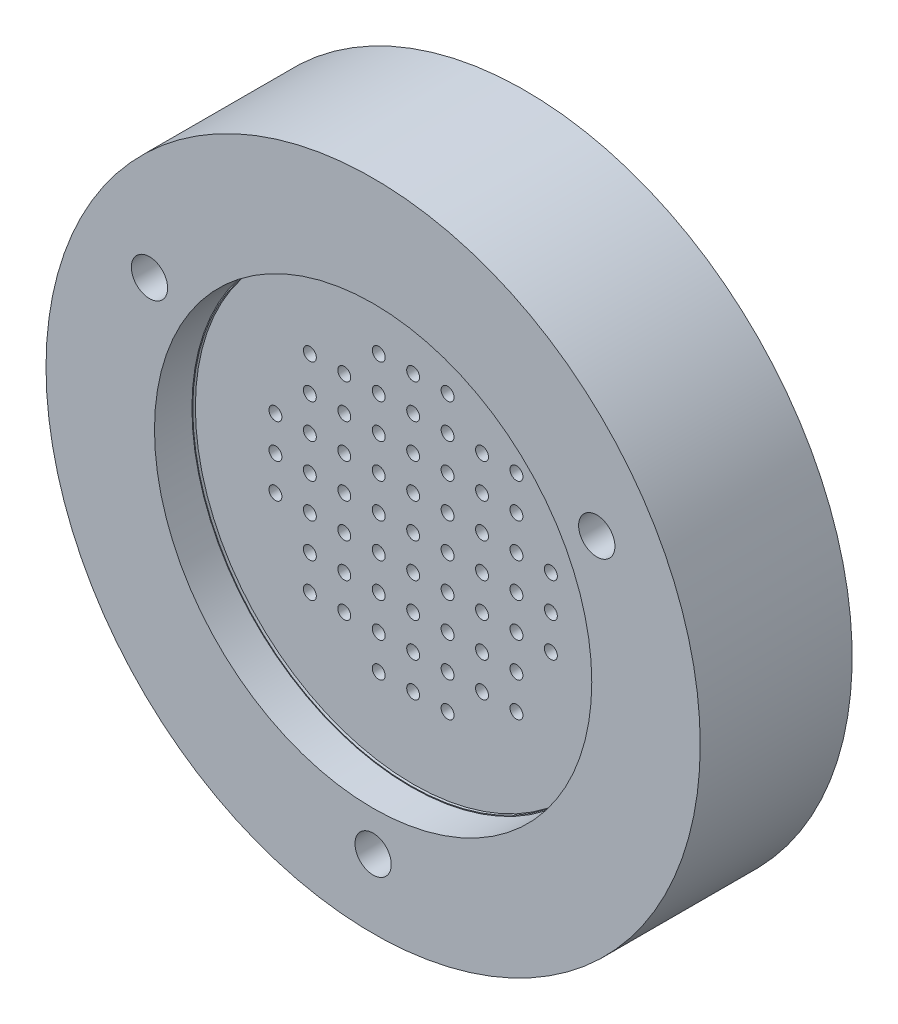
from build123d import *

# Parameters (mm, degrees)
SKETCH1_R                                  = 38
BOSS_EXTRUDE1_DEPTH                        = 5
SKETCH2_R                                  = 0.75
CUT_EXTRUDE1_DEPTH                         = 54.972215074
LPATTERN1_COUNT                            = 5
LPATTERN1_PITCH                            = 4
LPATTERN1_COUNT_DIR2                       = 5
LPATTERN1_PITCH_DIR2                       = 4
MIRROR1_COPY_1_SKETCH_R                    = 0.75
MIRROR1_COPY_1_DEPTH                       = 54.972215074
MIRROR1_COPY_2_SKETCH_R                    = 0.75
MIRROR1_COPY_2_DEPTH                       = 54.972215074
MIRROR1_COPY_3_SKETCH_R                    = 0.75
MIRROR1_COPY_3_DEPTH                       = 54.972215074
MIRROR1_COPY_4_SKETCH_R                    = 0.75
MIRROR1_COPY_4_DEPTH                       = 54.972215074
MIRROR1_COPY_5_SKETCH_R                    = 0.75
MIRROR1_COPY_5_DEPTH                       = 54.972215074
MIRROR1_COPY_6_SKETCH_R                    = 0.75
MIRROR1_COPY_6_DEPTH                       = 54.972215074
MIRROR1_COPY_7_SKETCH_R                    = 0.75
MIRROR1_COPY_7_DEPTH                       = 54.972215074
MIRROR1_COPY_8_SKETCH_R                    = 0.75
MIRROR1_COPY_8_DEPTH                       = 54.972215074
MIRROR1_COPY_9_SKETCH_R                    = 0.75
MIRROR1_COPY_9_DEPTH                       = 54.972215074
MIRROR1_COPY_10_SKETCH_R                   = 0.75
MIRROR1_COPY_10_DEPTH                      = 54.972215074
MIRROR1_COPY_11_SKETCH_R                   = 0.75
MIRROR1_COPY_11_DEPTH                      = 54.972215074
MIRROR1_COPY_12_SKETCH_R                   = 0.75
MIRROR1_COPY_12_DEPTH                      = 54.972215074
MIRROR1_COPY_13_SKETCH_R                   = 0.75
MIRROR1_COPY_13_DEPTH                      = 54.972215074
MIRROR1_COPY_14_SKETCH_R                   = 0.75
MIRROR1_COPY_14_DEPTH                      = 54.972215074
MIRROR1_COPY_15_SKETCH_R                   = 0.75
MIRROR1_COPY_15_DEPTH                      = 54.972215074
MIRROR1_COPY_16_SKETCH_R                   = 0.75
MIRROR1_COPY_16_DEPTH                      = 54.972215074
MIRROR1_COPY_17_SKETCH_R                   = 0.75
MIRROR1_COPY_17_DEPTH                      = 54.972215074
MIRROR1_COPY_18_SKETCH_R                   = 0.75
MIRROR1_COPY_18_DEPTH                      = 54.972215074
MIRROR1_COPY_19_SKETCH_R                   = 0.75
MIRROR1_COPY_19_DEPTH                      = 54.972215074
MIRROR1_COPY_20_SKETCH_R                   = 0.75
MIRROR1_COPY_20_DEPTH                      = 54.972215074
MIRROR1_AT_THE_SECOND_PLANE_COPY_1_SKETC_R = 0.75
MIRROR1_AT_THE_SECOND_PLANE_COPY_1_DEPTH   = 54.972215074
MIRROR1_AT_THE_SECOND_PLANE_COPY_2_SKETC_R = 0.75
MIRROR1_AT_THE_SECOND_PLANE_COPY_2_DEPTH   = 54.972215074
MIRROR1_AT_THE_SECOND_PLANE_COPY_3_SKETC_R = 0.75
MIRROR1_AT_THE_SECOND_PLANE_COPY_3_DEPTH   = 54.972215074
MIRROR1_AT_THE_SECOND_PLANE_COPY_4_SKETC_R = 0.75
MIRROR1_AT_THE_SECOND_PLANE_COPY_4_DEPTH   = 54.972215074
MIRROR1_AT_THE_SECOND_PLANE_COPY_5_SKETC_R = 0.75
MIRROR1_AT_THE_SECOND_PLANE_COPY_5_DEPTH   = 54.972215074
MIRROR1_AT_THE_SECOND_PLANE_COPY_6_SKETC_R = 0.75
MIRROR1_AT_THE_SECOND_PLANE_COPY_6_DEPTH   = 54.972215074
MIRROR1_AT_THE_SECOND_PLANE_COPY_7_SKETC_R = 0.75
MIRROR1_AT_THE_SECOND_PLANE_COPY_7_DEPTH   = 54.972215074
MIRROR1_AT_THE_SECOND_PLANE_COPY_8_SKETC_R = 0.75
MIRROR1_AT_THE_SECOND_PLANE_COPY_8_DEPTH   = 54.972215074
MIRROR1_AT_THE_SECOND_PLANE_COPY_9_SKETC_R = 0.75
MIRROR1_AT_THE_SECOND_PLANE_COPY_9_DEPTH   = 54.972215074
MIRROR1_AT_THE_SECOND_PLANE_COPY_10_SKET_R = 0.75
MIRROR1_AT_THE_SECOND_PLANE_COPY_10_DEPTH  = 54.972215074
MIRROR1_AT_THE_SECOND_PLANE_COPY_11_SKET_R = 0.75
MIRROR1_AT_THE_SECOND_PLANE_COPY_11_DEPTH  = 54.972215074
MIRROR1_AT_THE_SECOND_PLANE_COPY_12_SKET_R = 0.75
MIRROR1_AT_THE_SECOND_PLANE_COPY_12_DEPTH  = 54.972215074
MIRROR1_AT_THE_SECOND_PLANE_COPY_13_SKET_R = 0.75
MIRROR1_AT_THE_SECOND_PLANE_COPY_13_DEPTH  = 54.972215074
MIRROR1_AT_THE_SECOND_PLANE_COPY_14_SKET_R = 0.75
MIRROR1_AT_THE_SECOND_PLANE_COPY_14_DEPTH  = 54.972215074
MIRROR1_AT_THE_SECOND_PLANE_COPY_15_SKET_R = 0.75
MIRROR1_AT_THE_SECOND_PLANE_COPY_15_DEPTH  = 54.972215074
MIRROR1_AT_THE_SECOND_PLANE_COPY_16_SKET_R = 0.75
MIRROR1_AT_THE_SECOND_PLANE_COPY_16_DEPTH  = 54.972215074
MIRROR1_AT_THE_SECOND_PLANE_COPY_17_SKET_R = 0.75
MIRROR1_AT_THE_SECOND_PLANE_COPY_17_DEPTH  = 54.972215074
MIRROR1_AT_THE_SECOND_PLANE_COPY_18_SKET_R = 0.75
MIRROR1_AT_THE_SECOND_PLANE_COPY_18_DEPTH  = 54.972215074
MIRROR1_AT_THE_SECOND_PLANE_COPY_19_SKET_R = 0.75
MIRROR1_AT_THE_SECOND_PLANE_COPY_19_DEPTH  = 54.972215074
MIRROR1_AT_THE_SECOND_PLANE_COPY_20_SKET_R = 0.75
MIRROR1_AT_THE_SECOND_PLANE_COPY_20_DEPTH  = 54.972215074
MIRROR1_AT_THE_SECOND_PLANE_COPY_21_SKET_R = 0.75
MIRROR1_AT_THE_SECOND_PLANE_COPY_21_DEPTH  = 54.972215074
MIRROR1_AT_THE_SECOND_PLANE_COPY_22_SKET_R = 0.75
MIRROR1_AT_THE_SECOND_PLANE_COPY_22_DEPTH  = 54.972215074
MIRROR1_AT_THE_SECOND_PLANE_COPY_23_SKET_R = 0.75
MIRROR1_AT_THE_SECOND_PLANE_COPY_23_DEPTH  = 54.972215074
MIRROR1_AT_THE_SECOND_PLANE_COPY_24_SKET_R = 0.75
MIRROR1_AT_THE_SECOND_PLANE_COPY_24_DEPTH  = 54.972215074
MIRROR1_AT_THE_SECOND_PLANE_COPY_25_SKET_R = 0.75
MIRROR1_AT_THE_SECOND_PLANE_COPY_25_DEPTH  = 54.972215074
MIRROR1_AT_THE_SECOND_PLANE_COPY_26_SKET_R = 0.75
MIRROR1_AT_THE_SECOND_PLANE_COPY_26_DEPTH  = 54.972215074
MIRROR1_AT_THE_SECOND_PLANE_COPY_27_SKET_R = 0.75
MIRROR1_AT_THE_SECOND_PLANE_COPY_27_DEPTH  = 54.972215074
MIRROR1_AT_THE_SECOND_PLANE_COPY_28_SKET_R = 0.75
MIRROR1_AT_THE_SECOND_PLANE_COPY_28_DEPTH  = 54.972215074
MIRROR1_AT_THE_SECOND_PLANE_COPY_29_SKET_R = 0.75
MIRROR1_AT_THE_SECOND_PLANE_COPY_29_DEPTH  = 54.972215074
MIRROR1_AT_THE_SECOND_PLANE_COPY_30_SKET_R = 0.75
MIRROR1_AT_THE_SECOND_PLANE_COPY_30_DEPTH  = 54.972215074
MIRROR1_AT_THE_SECOND_PLANE_COPY_31_SKET_R = 0.75
MIRROR1_AT_THE_SECOND_PLANE_COPY_31_DEPTH  = 54.972215074
MIRROR1_AT_THE_SECOND_PLANE_COPY_32_SKET_R = 0.75
MIRROR1_AT_THE_SECOND_PLANE_COPY_32_DEPTH  = 54.972215074
MIRROR1_AT_THE_SECOND_PLANE_COPY_33_SKET_R = 0.75
MIRROR1_AT_THE_SECOND_PLANE_COPY_33_DEPTH  = 54.972215074
MIRROR1_AT_THE_SECOND_PLANE_COPY_34_SKET_R = 0.75
MIRROR1_AT_THE_SECOND_PLANE_COPY_34_DEPTH  = 54.972215074
MIRROR1_AT_THE_SECOND_PLANE_COPY_35_SKET_R = 0.75
MIRROR1_AT_THE_SECOND_PLANE_COPY_35_DEPTH  = 54.972215074
MIRROR1_AT_THE_SECOND_PLANE_COPY_36_SKET_R = 0.75
MIRROR1_AT_THE_SECOND_PLANE_COPY_36_DEPTH  = 54.972215074
MIRROR1_AT_THE_SECOND_PLANE_COPY_37_SKET_R = 0.75
MIRROR1_AT_THE_SECOND_PLANE_COPY_37_DEPTH  = 54.972215074
MIRROR1_AT_THE_SECOND_PLANE_COPY_38_SKET_R = 0.75
MIRROR1_AT_THE_SECOND_PLANE_COPY_38_DEPTH  = 54.972215074
MIRROR1_AT_THE_SECOND_PLANE_COPY_39_SKET_R = 0.75
MIRROR1_AT_THE_SECOND_PLANE_COPY_39_DEPTH  = 54.972215074
MIRROR1_AT_THE_SECOND_PLANE_COPY_40_SKET_R = 0.75
MIRROR1_AT_THE_SECOND_PLANE_COPY_40_DEPTH  = 54.972215074
MIRROR1_AT_THE_SECOND_PLANE_COPY_41_SKET_R = 0.75
MIRROR1_AT_THE_SECOND_PLANE_COPY_41_DEPTH  = 54.972215074
SKETCH16_R                                 = 38
SKETCH16_R_2                               = 25.4
BOSS_EXTRUDE2_DEPTH                        = 4.65
BOSS_EXTRUDE3_START                        = 8
SKETCH17_R                                 = 38
SKETCH17_R_2                               = 33
BOSS_EXTRUDE3_DEPTH                        = 8
HOLE_FOR_4_300_SC_NUTS_SP_3_D              = 4.2164
CIRPATTERN1_COUNT                          = 3
CIRPATTERN2_COUNT                          = 3
SKETCH43_R                                 = 26.3
SKETCH43_R_2                               = 25.3
BOSS_EXTRUDE4_DEPTH                        = 0.3


with BuildPart() as part:
    # Sketch1 → Boss-Extrude1 (new body)
    with BuildSketch(Plane.XY):
        Circle(SKETCH1_R)
    extrude(amount=BOSS_EXTRUDE1_DEPTH)

    # Sketch2 → Cut-Extrude1 (cut, through all)
    with BuildSketch(Plane.XY.offset(5)):
        Circle(SKETCH2_R)
    cut_extrude1 = extrude(amount=-CUT_EXTRUDE1_DEPTH, mode=Mode.SUBTRACT)

    # LPattern1: Cut-Extrude1 5 × 5, 5 skipped
    with Locations(*[(j * LPATTERN1_PITCH_DIR2, i * LPATTERN1_PITCH, 0) for i in range(LPATTERN1_COUNT) for j in range(LPATTERN1_COUNT_DIR2) if (i, j) not in ((0, 0), (2, 4), (3, 4), (4, 2), (4, 3), (4, 4))]):
        add(cut_extrude1, mode=Mode.SUBTRACT)

    # Mirror1 copy 1 sketch → Mirror1 copy 1 (cut, through all)
    with BuildSketch(Plane(origin=(-4, 0, 5), x_dir=(-1, 0, 0), z_dir=(0, 0, 1))):
        Circle(MIRROR1_COPY_1_SKETCH_R)
    extrude(amount=-MIRROR1_COPY_1_DEPTH, mode=Mode.SUBTRACT)

    # Mirror1 copy 2 sketch → Mirror1 copy 2 (cut, through all)
    with BuildSketch(Plane(origin=(-8, 0, 5), x_dir=(-1, 0, 0), z_dir=(0, 0, 1))):
        Circle(MIRROR1_COPY_2_SKETCH_R)
    extrude(amount=-MIRROR1_COPY_2_DEPTH, mode=Mode.SUBTRACT)

    # Mirror1 copy 3 sketch → Mirror1 copy 3 (cut, through all)
    with BuildSketch(Plane(origin=(-12, 0, 5), x_dir=(-1, 0, 0), z_dir=(0, 0, 1))):
        Circle(MIRROR1_COPY_3_SKETCH_R)
    extrude(amount=-MIRROR1_COPY_3_DEPTH, mode=Mode.SUBTRACT)

    # Mirror1 copy 4 sketch → Mirror1 copy 4 (cut, through all)
    with BuildSketch(Plane(origin=(-16, 0, 5), x_dir=(-1, 0, 0), z_dir=(0, 0, 1))):
        Circle(MIRROR1_COPY_4_SKETCH_R)
    extrude(amount=-MIRROR1_COPY_4_DEPTH, mode=Mode.SUBTRACT)

    # Mirror1 copy 5 sketch → Mirror1 copy 5 (cut, through all)
    with BuildSketch(Plane(origin=(0, 4, 5), x_dir=(-1, 0, 0), z_dir=(0, 0, 1))):
        Circle(MIRROR1_COPY_5_SKETCH_R)
    extrude(amount=-MIRROR1_COPY_5_DEPTH, mode=Mode.SUBTRACT)

    # Mirror1 copy 6 sketch → Mirror1 copy 6 (cut, through all)
    with BuildSketch(Plane(origin=(-4, 4, 5), x_dir=(-1, 0, 0), z_dir=(0, 0, 1))):
        Circle(MIRROR1_COPY_6_SKETCH_R)
    extrude(amount=-MIRROR1_COPY_6_DEPTH, mode=Mode.SUBTRACT)

    # Mirror1 copy 7 sketch → Mirror1 copy 7 (cut, through all)
    with BuildSketch(Plane(origin=(-8, 4, 5), x_dir=(-1, 0, 0), z_dir=(0, 0, 1))):
        Circle(MIRROR1_COPY_7_SKETCH_R)
    extrude(amount=-MIRROR1_COPY_7_DEPTH, mode=Mode.SUBTRACT)

    # Mirror1 copy 8 sketch → Mirror1 copy 8 (cut, through all)
    with BuildSketch(Plane(origin=(-12, 4, 5), x_dir=(-1, 0, 0), z_dir=(0, 0, 1))):
        Circle(MIRROR1_COPY_8_SKETCH_R)
    extrude(amount=-MIRROR1_COPY_8_DEPTH, mode=Mode.SUBTRACT)

    # Mirror1 copy 9 sketch → Mirror1 copy 9 (cut, through all)
    with BuildSketch(Plane(origin=(-16, 4, 5), x_dir=(-1, 0, 0), z_dir=(0, 0, 1))):
        Circle(MIRROR1_COPY_9_SKETCH_R)
    extrude(amount=-MIRROR1_COPY_9_DEPTH, mode=Mode.SUBTRACT)

    # Mirror1 copy 10 sketch → Mirror1 copy 10 (cut, through all)
    with BuildSketch(Plane(origin=(0, 8, 5), x_dir=(-1, 0, 0), z_dir=(0, 0, 1))):
        Circle(MIRROR1_COPY_10_SKETCH_R)
    extrude(amount=-MIRROR1_COPY_10_DEPTH, mode=Mode.SUBTRACT)

    # Mirror1 copy 11 sketch → Mirror1 copy 11 (cut, through all)
    with BuildSketch(Plane(origin=(-4, 8, 5), x_dir=(-1, 0, 0), z_dir=(0, 0, 1))):
        Circle(MIRROR1_COPY_11_SKETCH_R)
    extrude(amount=-MIRROR1_COPY_11_DEPTH, mode=Mode.SUBTRACT)

    # Mirror1 copy 12 sketch → Mirror1 copy 12 (cut, through all)
    with BuildSketch(Plane(origin=(-8, 8, 5), x_dir=(-1, 0, 0), z_dir=(0, 0, 1))):
        Circle(MIRROR1_COPY_12_SKETCH_R)
    extrude(amount=-MIRROR1_COPY_12_DEPTH, mode=Mode.SUBTRACT)

    # Mirror1 copy 13 sketch → Mirror1 copy 13 (cut, through all)
    with BuildSketch(Plane(origin=(-12, 8, 5), x_dir=(-1, 0, 0), z_dir=(0, 0, 1))):
        Circle(MIRROR1_COPY_13_SKETCH_R)
    extrude(amount=-MIRROR1_COPY_13_DEPTH, mode=Mode.SUBTRACT)

    # Mirror1 copy 14 sketch → Mirror1 copy 14 (cut, through all)
    with BuildSketch(Plane(origin=(0, 12, 5), x_dir=(-1, 0, 0), z_dir=(0, 0, 1))):
        Circle(MIRROR1_COPY_14_SKETCH_R)
    extrude(amount=-MIRROR1_COPY_14_DEPTH, mode=Mode.SUBTRACT)

    # Mirror1 copy 15 sketch → Mirror1 copy 15 (cut, through all)
    with BuildSketch(Plane(origin=(-4, 12, 5), x_dir=(-1, 0, 0), z_dir=(0, 0, 1))):
        Circle(MIRROR1_COPY_15_SKETCH_R)
    extrude(amount=-MIRROR1_COPY_15_DEPTH, mode=Mode.SUBTRACT)

    # Mirror1 copy 16 sketch → Mirror1 copy 16 (cut, through all)
    with BuildSketch(Plane(origin=(-8, 12, 5), x_dir=(-1, 0, 0), z_dir=(0, 0, 1))):
        Circle(MIRROR1_COPY_16_SKETCH_R)
    extrude(amount=-MIRROR1_COPY_16_DEPTH, mode=Mode.SUBTRACT)

    # Mirror1 copy 17 sketch → Mirror1 copy 17 (cut, through all)
    with BuildSketch(Plane(origin=(-12, 12, 5), x_dir=(-1, 0, 0), z_dir=(0, 0, 1))):
        Circle(MIRROR1_COPY_17_SKETCH_R)
    extrude(amount=-MIRROR1_COPY_17_DEPTH, mode=Mode.SUBTRACT)

    # Mirror1 copy 18 sketch → Mirror1 copy 18 (cut, through all)
    with BuildSketch(Plane(origin=(0, 16, 5), x_dir=(-1, 0, 0), z_dir=(0, 0, 1))):
        Circle(MIRROR1_COPY_18_SKETCH_R)
    extrude(amount=-MIRROR1_COPY_18_DEPTH, mode=Mode.SUBTRACT)

    # Mirror1 copy 19 sketch → Mirror1 copy 19 (cut, through all)
    with BuildSketch(Plane(origin=(-4, 16, 5), x_dir=(-1, 0, 0), z_dir=(0, 0, 1))):
        Circle(MIRROR1_COPY_19_SKETCH_R)
    extrude(amount=-MIRROR1_COPY_19_DEPTH, mode=Mode.SUBTRACT)

    # Mirror1 copy 20 sketch → Mirror1 copy 20 (cut, through all)
    with BuildSketch(Plane(origin=(0, 0, 5), x_dir=(-1, 0, 0), z_dir=(0, 0, 1))):
        Circle(MIRROR1_COPY_20_SKETCH_R)
    extrude(amount=-MIRROR1_COPY_20_DEPTH, mode=Mode.SUBTRACT)

    # Mirror1 at the second plane copy 1 sketc → Mirror1 at the second plane copy 1 (cut, through all)
    with BuildSketch(Plane(origin=(4, 0, 5), x_dir=(1, 0, 0), z_dir=(0, 0, 1))):
        Circle(MIRROR1_AT_THE_SECOND_PLANE_COPY_1_SKETC_R)
    extrude(amount=-MIRROR1_AT_THE_SECOND_PLANE_COPY_1_DEPTH, mode=Mode.SUBTRACT)

    # Mirror1 at the second plane copy 2 sketc → Mirror1 at the second plane copy 2 (cut, through all)
    with BuildSketch(Plane(origin=(8, 0, 5), x_dir=(1, 0, 0), z_dir=(0, 0, 1))):
        Circle(MIRROR1_AT_THE_SECOND_PLANE_COPY_2_SKETC_R)
    extrude(amount=-MIRROR1_AT_THE_SECOND_PLANE_COPY_2_DEPTH, mode=Mode.SUBTRACT)

    # Mirror1 at the second plane copy 3 sketc → Mirror1 at the second plane copy 3 (cut, through all)
    with BuildSketch(Plane(origin=(12, 0, 5), x_dir=(1, 0, 0), z_dir=(0, 0, 1))):
        Circle(MIRROR1_AT_THE_SECOND_PLANE_COPY_3_SKETC_R)
    extrude(amount=-MIRROR1_AT_THE_SECOND_PLANE_COPY_3_DEPTH, mode=Mode.SUBTRACT)

    # Mirror1 at the second plane copy 4 sketc → Mirror1 at the second plane copy 4 (cut, through all)
    with BuildSketch(Plane(origin=(16, 0, 5), x_dir=(1, 0, 0), z_dir=(0, 0, 1))):
        Circle(MIRROR1_AT_THE_SECOND_PLANE_COPY_4_SKETC_R)
    extrude(amount=-MIRROR1_AT_THE_SECOND_PLANE_COPY_4_DEPTH, mode=Mode.SUBTRACT)

    # Mirror1 at the second plane copy 5 sketc → Mirror1 at the second plane copy 5 (cut, through all)
    with BuildSketch(Plane(origin=(0, -4, 5), x_dir=(1, 0, 0), z_dir=(0, 0, 1))):
        Circle(MIRROR1_AT_THE_SECOND_PLANE_COPY_5_SKETC_R)
    extrude(amount=-MIRROR1_AT_THE_SECOND_PLANE_COPY_5_DEPTH, mode=Mode.SUBTRACT)

    # Mirror1 at the second plane copy 6 sketc → Mirror1 at the second plane copy 6 (cut, through all)
    with BuildSketch(Plane(origin=(4, -4, 5), x_dir=(1, 0, 0), z_dir=(0, 0, 1))):
        Circle(MIRROR1_AT_THE_SECOND_PLANE_COPY_6_SKETC_R)
    extrude(amount=-MIRROR1_AT_THE_SECOND_PLANE_COPY_6_DEPTH, mode=Mode.SUBTRACT)

    # Mirror1 at the second plane copy 7 sketc → Mirror1 at the second plane copy 7 (cut, through all)
    with BuildSketch(Plane(origin=(8, -4, 5), x_dir=(1, 0, 0), z_dir=(0, 0, 1))):
        Circle(MIRROR1_AT_THE_SECOND_PLANE_COPY_7_SKETC_R)
    extrude(amount=-MIRROR1_AT_THE_SECOND_PLANE_COPY_7_DEPTH, mode=Mode.SUBTRACT)

    # Mirror1 at the second plane copy 8 sketc → Mirror1 at the second plane copy 8 (cut, through all)
    with BuildSketch(Plane(origin=(12, -4, 5), x_dir=(1, 0, 0), z_dir=(0, 0, 1))):
        Circle(MIRROR1_AT_THE_SECOND_PLANE_COPY_8_SKETC_R)
    extrude(amount=-MIRROR1_AT_THE_SECOND_PLANE_COPY_8_DEPTH, mode=Mode.SUBTRACT)

    # Mirror1 at the second plane copy 9 sketc → Mirror1 at the second plane copy 9 (cut, through all)
    with BuildSketch(Plane(origin=(16, -4, 5), x_dir=(1, 0, 0), z_dir=(0, 0, 1))):
        Circle(MIRROR1_AT_THE_SECOND_PLANE_COPY_9_SKETC_R)
    extrude(amount=-MIRROR1_AT_THE_SECOND_PLANE_COPY_9_DEPTH, mode=Mode.SUBTRACT)

    # Mirror1 at the second plane copy 10 sket → Mirror1 at the second plane copy 10 (cut, through all)
    with BuildSketch(Plane(origin=(0, -8, 5), x_dir=(1, 0, 0), z_dir=(0, 0, 1))):
        Circle(MIRROR1_AT_THE_SECOND_PLANE_COPY_10_SKET_R)
    extrude(amount=-MIRROR1_AT_THE_SECOND_PLANE_COPY_10_DEPTH, mode=Mode.SUBTRACT)

    # Mirror1 at the second plane copy 11 sket → Mirror1 at the second plane copy 11 (cut, through all)
    with BuildSketch(Plane(origin=(4, -8, 5), x_dir=(1, 0, 0), z_dir=(0, 0, 1))):
        Circle(MIRROR1_AT_THE_SECOND_PLANE_COPY_11_SKET_R)
    extrude(amount=-MIRROR1_AT_THE_SECOND_PLANE_COPY_11_DEPTH, mode=Mode.SUBTRACT)

    # Mirror1 at the second plane copy 12 sket → Mirror1 at the second plane copy 12 (cut, through all)
    with BuildSketch(Plane(origin=(8, -8, 5), x_dir=(1, 0, 0), z_dir=(0, 0, 1))):
        Circle(MIRROR1_AT_THE_SECOND_PLANE_COPY_12_SKET_R)
    extrude(amount=-MIRROR1_AT_THE_SECOND_PLANE_COPY_12_DEPTH, mode=Mode.SUBTRACT)

    # Mirror1 at the second plane copy 13 sket → Mirror1 at the second plane copy 13 (cut, through all)
    with BuildSketch(Plane(origin=(12, -8, 5), x_dir=(1, 0, 0), z_dir=(0, 0, 1))):
        Circle(MIRROR1_AT_THE_SECOND_PLANE_COPY_13_SKET_R)
    extrude(amount=-MIRROR1_AT_THE_SECOND_PLANE_COPY_13_DEPTH, mode=Mode.SUBTRACT)

    # Mirror1 at the second plane copy 14 sket → Mirror1 at the second plane copy 14 (cut, through all)
    with BuildSketch(Plane(origin=(0, -12, 5), x_dir=(1, 0, 0), z_dir=(0, 0, 1))):
        Circle(MIRROR1_AT_THE_SECOND_PLANE_COPY_14_SKET_R)
    extrude(amount=-MIRROR1_AT_THE_SECOND_PLANE_COPY_14_DEPTH, mode=Mode.SUBTRACT)

    # Mirror1 at the second plane copy 15 sket → Mirror1 at the second plane copy 15 (cut, through all)
    with BuildSketch(Plane(origin=(4, -12, 5), x_dir=(1, 0, 0), z_dir=(0, 0, 1))):
        Circle(MIRROR1_AT_THE_SECOND_PLANE_COPY_15_SKET_R)
    extrude(amount=-MIRROR1_AT_THE_SECOND_PLANE_COPY_15_DEPTH, mode=Mode.SUBTRACT)

    # Mirror1 at the second plane copy 16 sket → Mirror1 at the second plane copy 16 (cut, through all)
    with BuildSketch(Plane(origin=(8, -12, 5), x_dir=(1, 0, 0), z_dir=(0, 0, 1))):
        Circle(MIRROR1_AT_THE_SECOND_PLANE_COPY_16_SKET_R)
    extrude(amount=-MIRROR1_AT_THE_SECOND_PLANE_COPY_16_DEPTH, mode=Mode.SUBTRACT)

    # Mirror1 at the second plane copy 17 sket → Mirror1 at the second plane copy 17 (cut, through all)
    with BuildSketch(Plane(origin=(12, -12, 5), x_dir=(1, 0, 0), z_dir=(0, 0, 1))):
        Circle(MIRROR1_AT_THE_SECOND_PLANE_COPY_17_SKET_R)
    extrude(amount=-MIRROR1_AT_THE_SECOND_PLANE_COPY_17_DEPTH, mode=Mode.SUBTRACT)

    # Mirror1 at the second plane copy 18 sket → Mirror1 at the second plane copy 18 (cut, through all)
    with BuildSketch(Plane(origin=(0, -16, 5), x_dir=(1, 0, 0), z_dir=(0, 0, 1))):
        Circle(MIRROR1_AT_THE_SECOND_PLANE_COPY_18_SKET_R)
    extrude(amount=-MIRROR1_AT_THE_SECOND_PLANE_COPY_18_DEPTH, mode=Mode.SUBTRACT)

    # Mirror1 at the second plane copy 19 sket → Mirror1 at the second plane copy 19 (cut, through all)
    with BuildSketch(Plane(origin=(4, -16, 5), x_dir=(1, 0, 0), z_dir=(0, 0, 1))):
        Circle(MIRROR1_AT_THE_SECOND_PLANE_COPY_19_SKET_R)
    extrude(amount=-MIRROR1_AT_THE_SECOND_PLANE_COPY_19_DEPTH, mode=Mode.SUBTRACT)

    # Mirror1 at the second plane copy 20 sket → Mirror1 at the second plane copy 20 (cut, through all)
    with BuildSketch(Plane.XY.offset(5)):
        Circle(MIRROR1_AT_THE_SECOND_PLANE_COPY_20_SKET_R)
    extrude(amount=-MIRROR1_AT_THE_SECOND_PLANE_COPY_20_DEPTH, mode=Mode.SUBTRACT)

    # Mirror1 at the second plane copy 21 sket → Mirror1 at the second plane copy 21 (cut, through all)
    with BuildSketch(Plane(origin=(-4, 0, 5), x_dir=(-1, 0, 0), z_dir=(0, 0, 1))):
        Circle(MIRROR1_AT_THE_SECOND_PLANE_COPY_21_SKET_R)
    extrude(amount=-MIRROR1_AT_THE_SECOND_PLANE_COPY_21_DEPTH, mode=Mode.SUBTRACT)

    # Mirror1 at the second plane copy 22 sket → Mirror1 at the second plane copy 22 (cut, through all)
    with BuildSketch(Plane(origin=(-8, 0, 5), x_dir=(-1, 0, 0), z_dir=(0, 0, 1))):
        Circle(MIRROR1_AT_THE_SECOND_PLANE_COPY_22_SKET_R)
    extrude(amount=-MIRROR1_AT_THE_SECOND_PLANE_COPY_22_DEPTH, mode=Mode.SUBTRACT)

    # Mirror1 at the second plane copy 23 sket → Mirror1 at the second plane copy 23 (cut, through all)
    with BuildSketch(Plane(origin=(-12, 0, 5), x_dir=(-1, 0, 0), z_dir=(0, 0, 1))):
        Circle(MIRROR1_AT_THE_SECOND_PLANE_COPY_23_SKET_R)
    extrude(amount=-MIRROR1_AT_THE_SECOND_PLANE_COPY_23_DEPTH, mode=Mode.SUBTRACT)

    # Mirror1 at the second plane copy 24 sket → Mirror1 at the second plane copy 24 (cut, through all)
    with BuildSketch(Plane(origin=(-16, 0, 5), x_dir=(-1, 0, 0), z_dir=(0, 0, 1))):
        Circle(MIRROR1_AT_THE_SECOND_PLANE_COPY_24_SKET_R)
    extrude(amount=-MIRROR1_AT_THE_SECOND_PLANE_COPY_24_DEPTH, mode=Mode.SUBTRACT)

    # Mirror1 at the second plane copy 25 sket → Mirror1 at the second plane copy 25 (cut, through all)
    with BuildSketch(Plane(origin=(0, -4, 5), x_dir=(-1, 0, 0), z_dir=(0, 0, 1))):
        Circle(MIRROR1_AT_THE_SECOND_PLANE_COPY_25_SKET_R)
    extrude(amount=-MIRROR1_AT_THE_SECOND_PLANE_COPY_25_DEPTH, mode=Mode.SUBTRACT)

    # Mirror1 at the second plane copy 26 sket → Mirror1 at the second plane copy 26 (cut, through all)
    with BuildSketch(Plane(origin=(-4, -4, 5), x_dir=(-1, 0, 0), z_dir=(0, 0, 1))):
        Circle(MIRROR1_AT_THE_SECOND_PLANE_COPY_26_SKET_R)
    extrude(amount=-MIRROR1_AT_THE_SECOND_PLANE_COPY_26_DEPTH, mode=Mode.SUBTRACT)

    # Mirror1 at the second plane copy 27 sket → Mirror1 at the second plane copy 27 (cut, through all)
    with BuildSketch(Plane(origin=(-8, -4, 5), x_dir=(-1, 0, 0), z_dir=(0, 0, 1))):
        Circle(MIRROR1_AT_THE_SECOND_PLANE_COPY_27_SKET_R)
    extrude(amount=-MIRROR1_AT_THE_SECOND_PLANE_COPY_27_DEPTH, mode=Mode.SUBTRACT)

    # Mirror1 at the second plane copy 28 sket → Mirror1 at the second plane copy 28 (cut, through all)
    with BuildSketch(Plane(origin=(-12, -4, 5), x_dir=(-1, 0, 0), z_dir=(0, 0, 1))):
        Circle(MIRROR1_AT_THE_SECOND_PLANE_COPY_28_SKET_R)
    extrude(amount=-MIRROR1_AT_THE_SECOND_PLANE_COPY_28_DEPTH, mode=Mode.SUBTRACT)

    # Mirror1 at the second plane copy 29 sket → Mirror1 at the second plane copy 29 (cut, through all)
    with BuildSketch(Plane(origin=(-16, -4, 5), x_dir=(-1, 0, 0), z_dir=(0, 0, 1))):
        Circle(MIRROR1_AT_THE_SECOND_PLANE_COPY_29_SKET_R)
    extrude(amount=-MIRROR1_AT_THE_SECOND_PLANE_COPY_29_DEPTH, mode=Mode.SUBTRACT)

    # Mirror1 at the second plane copy 30 sket → Mirror1 at the second plane copy 30 (cut, through all)
    with BuildSketch(Plane(origin=(0, -8, 5), x_dir=(-1, 0, 0), z_dir=(0, 0, 1))):
        Circle(MIRROR1_AT_THE_SECOND_PLANE_COPY_30_SKET_R)
    extrude(amount=-MIRROR1_AT_THE_SECOND_PLANE_COPY_30_DEPTH, mode=Mode.SUBTRACT)

    # Mirror1 at the second plane copy 31 sket → Mirror1 at the second plane copy 31 (cut, through all)
    with BuildSketch(Plane(origin=(-4, -8, 5), x_dir=(-1, 0, 0), z_dir=(0, 0, 1))):
        Circle(MIRROR1_AT_THE_SECOND_PLANE_COPY_31_SKET_R)
    extrude(amount=-MIRROR1_AT_THE_SECOND_PLANE_COPY_31_DEPTH, mode=Mode.SUBTRACT)

    # Mirror1 at the second plane copy 32 sket → Mirror1 at the second plane copy 32 (cut, through all)
    with BuildSketch(Plane(origin=(-8, -8, 5), x_dir=(-1, 0, 0), z_dir=(0, 0, 1))):
        Circle(MIRROR1_AT_THE_SECOND_PLANE_COPY_32_SKET_R)
    extrude(amount=-MIRROR1_AT_THE_SECOND_PLANE_COPY_32_DEPTH, mode=Mode.SUBTRACT)

    # Mirror1 at the second plane copy 33 sket → Mirror1 at the second plane copy 33 (cut, through all)
    with BuildSketch(Plane(origin=(-12, -8, 5), x_dir=(-1, 0, 0), z_dir=(0, 0, 1))):
        Circle(MIRROR1_AT_THE_SECOND_PLANE_COPY_33_SKET_R)
    extrude(amount=-MIRROR1_AT_THE_SECOND_PLANE_COPY_33_DEPTH, mode=Mode.SUBTRACT)

    # Mirror1 at the second plane copy 34 sket → Mirror1 at the second plane copy 34 (cut, through all)
    with BuildSketch(Plane(origin=(0, -12, 5), x_dir=(-1, 0, 0), z_dir=(0, 0, 1))):
        Circle(MIRROR1_AT_THE_SECOND_PLANE_COPY_34_SKET_R)
    extrude(amount=-MIRROR1_AT_THE_SECOND_PLANE_COPY_34_DEPTH, mode=Mode.SUBTRACT)

    # Mirror1 at the second plane copy 35 sket → Mirror1 at the second plane copy 35 (cut, through all)
    with BuildSketch(Plane(origin=(-4, -12, 5), x_dir=(-1, 0, 0), z_dir=(0, 0, 1))):
        Circle(MIRROR1_AT_THE_SECOND_PLANE_COPY_35_SKET_R)
    extrude(amount=-MIRROR1_AT_THE_SECOND_PLANE_COPY_35_DEPTH, mode=Mode.SUBTRACT)

    # Mirror1 at the second plane copy 36 sket → Mirror1 at the second plane copy 36 (cut, through all)
    with BuildSketch(Plane(origin=(-8, -12, 5), x_dir=(-1, 0, 0), z_dir=(0, 0, 1))):
        Circle(MIRROR1_AT_THE_SECOND_PLANE_COPY_36_SKET_R)
    extrude(amount=-MIRROR1_AT_THE_SECOND_PLANE_COPY_36_DEPTH, mode=Mode.SUBTRACT)

    # Mirror1 at the second plane copy 37 sket → Mirror1 at the second plane copy 37 (cut, through all)
    with BuildSketch(Plane(origin=(-12, -12, 5), x_dir=(-1, 0, 0), z_dir=(0, 0, 1))):
        Circle(MIRROR1_AT_THE_SECOND_PLANE_COPY_37_SKET_R)
    extrude(amount=-MIRROR1_AT_THE_SECOND_PLANE_COPY_37_DEPTH, mode=Mode.SUBTRACT)

    # Mirror1 at the second plane copy 38 sket → Mirror1 at the second plane copy 38 (cut, through all)
    with BuildSketch(Plane(origin=(0, -16, 5), x_dir=(-1, 0, 0), z_dir=(0, 0, 1))):
        Circle(MIRROR1_AT_THE_SECOND_PLANE_COPY_38_SKET_R)
    extrude(amount=-MIRROR1_AT_THE_SECOND_PLANE_COPY_38_DEPTH, mode=Mode.SUBTRACT)

    # Mirror1 at the second plane copy 39 sket → Mirror1 at the second plane copy 39 (cut, through all)
    with BuildSketch(Plane(origin=(-4, -16, 5), x_dir=(-1, 0, 0), z_dir=(0, 0, 1))):
        Circle(MIRROR1_AT_THE_SECOND_PLANE_COPY_39_SKET_R)
    extrude(amount=-MIRROR1_AT_THE_SECOND_PLANE_COPY_39_DEPTH, mode=Mode.SUBTRACT)

    # Mirror1 at the second plane copy 40 sket → Mirror1 at the second plane copy 40 (cut, through all)
    with BuildSketch(Plane(origin=(0, 0, 5), x_dir=(-1, 0, 0), z_dir=(0, 0, 1))):
        Circle(MIRROR1_AT_THE_SECOND_PLANE_COPY_40_SKET_R)
    extrude(amount=-MIRROR1_AT_THE_SECOND_PLANE_COPY_40_DEPTH, mode=Mode.SUBTRACT)

    # Mirror1 at the second plane copy 41 sket → Mirror1 at the second plane copy 41 (cut, through all)
    with BuildSketch(Plane.XY.offset(5)):
        Circle(MIRROR1_AT_THE_SECOND_PLANE_COPY_41_SKET_R)
    extrude(amount=-MIRROR1_AT_THE_SECOND_PLANE_COPY_41_DEPTH, mode=Mode.SUBTRACT)

    # Sketch16 → Boss-Extrude2 (add)
    with BuildSketch(Plane.XY.offset(5)):
        Circle(SKETCH16_R)
        Circle(SKETCH16_R_2, mode=Mode.SUBTRACT)
    extrude(amount=BOSS_EXTRUDE2_DEPTH)

    # Sketch17 → Boss-Extrude3 (add)
    with BuildSketch(Plane(origin=(0, 0, 0), x_dir=(-1, 0, 0), z_dir=(0, 0, -1)).offset(BOSS_EXTRUDE3_START)):
        Circle(SKETCH17_R)
        Circle(SKETCH17_R_2, mode=Mode.SUBTRACT)
    extrude(amount=-BOSS_EXTRUDE3_DEPTH)

    # Hole for #4 300® SC Nuts (SP)3 (through all)
    with Locations(Plane(origin=(0, 0, 0), x_dir=(-1, 0, 0), z_dir=(0, 0, -1))):
        with Locations((0, -30)):
            hole_for_4_300_sc_nuts_sp_3 = Hole(HOLE_FOR_4_300_SC_NUTS_SP_3_D / 2)

    # CirPattern1: Hole for #4 300® SC Nuts (SP)3 ×3 about axis
    cirpattern1_axis = Axis((0, 0, 0), (0, 0, 1))
    for i in range(1, CIRPATTERN1_COUNT):
        add(hole_for_4_300_sc_nuts_sp_3.rotate(cirpattern1_axis, i * 360 / CIRPATTERN1_COUNT), mode=Mode.SUBTRACT)

    # Sketch41 → Hole for #4 300® SC Nuts (SP)4 (revolve, cut)
    with BuildSketch(Plane(origin=(0, -35.5, -8), x_dir=(0, 1, 0), z_dir=(1, 0, 0))):
        Polygon((0, 0), (0, 6.266734357), (2.1082, 5), (2.1082, 0), align=None)
    hole_for_4_300_sc_nuts_sp_4 = revolve(axis=Axis((0, -35.5, -14.35), (0, 0, 1)), mode=Mode.SUBTRACT)

    # CirPattern2: Hole for #4 300® SC Nuts (SP)4 ×3 about axis
    cirpattern2_axis = Axis((0, 0, 0), (0, 0, 1))
    for i in range(1, CIRPATTERN2_COUNT):
        add(hole_for_4_300_sc_nuts_sp_4.rotate(cirpattern2_axis, i * 360 / CIRPATTERN2_COUNT), mode=Mode.SUBTRACT)

    # Sketch43 → Boss-Extrude4 (add)
    with BuildSketch(Plane.XY.offset(5)):
        Circle(SKETCH43_R)
        Circle(SKETCH43_R_2, mode=Mode.SUBTRACT)
    extrude(amount=BOSS_EXTRUDE4_DEPTH)


solid = part.part
